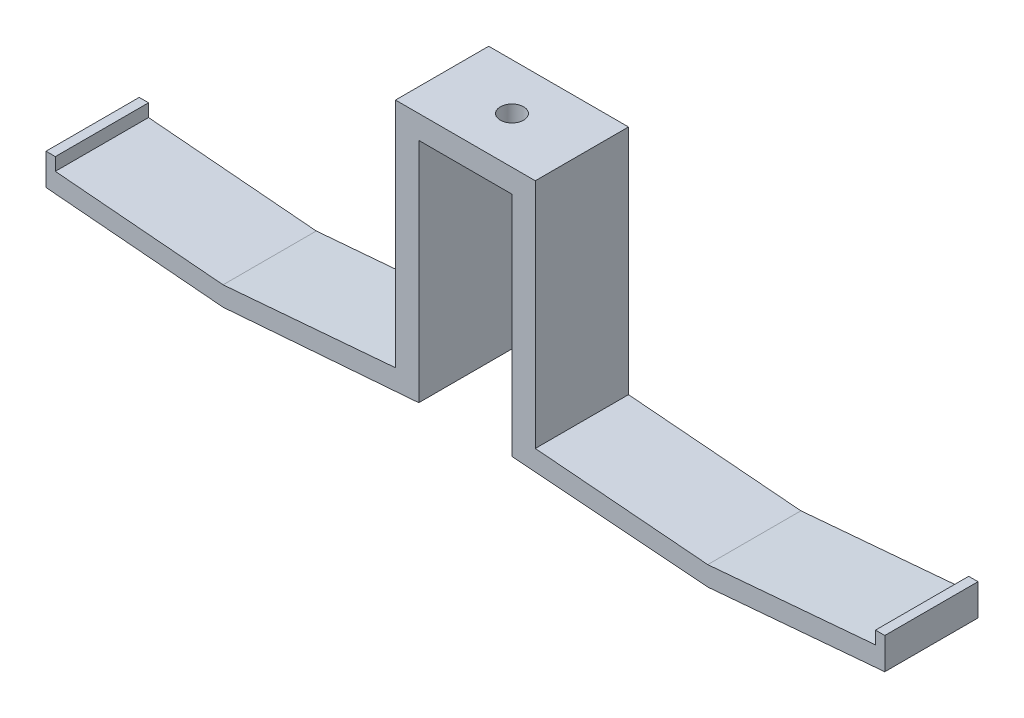
from build123d import *

# Parameters (mm, degrees)
BOSS_EXTRUDE1_DEPTH = 25.4
CUT_EXTRUDE1_REACH  = 139.665
SKETCH3_R           = 3.175


with BuildPart() as part:
    # Sketch2 → Boss-Extrude1 (new body)
    with BuildSketch(Plane.XY):
        Polygon((0, 0), (12.7, 0), (12.7, -61.9179737), (66.04, -66.051353419), (114.3, -61.9179737), (114.3, -53.351353419), (111.76, -53.351353419), (111.76, -56.8379737), (66.04, -60.753807118), (19.05, -56.8379737), (19.05, 0), (19.05, 6.35), (0, 6.35), align=None)
        Polygon((-12.7, 0), (0, 0), (0, 6.35), (-19.05, 6.35), (-19.05, 0), (-19.05, -56.8379737), (-66.04, -60.753807118), (-111.76, -56.8379737), (-111.76, -53.351353419), (-114.3, -53.351353419), (-114.3, -61.9179737), (-66.04, -66.051353419), (-12.7, -61.9179737), align=None)
    extrude(amount=BOSS_EXTRUDE1_DEPTH)

    # Sketch3 → Cut-Extrude1 (cut, up to next)
    with BuildSketch(Plane(origin=(0, 6.35, 0), x_dir=(1, 0, 0), z_dir=(0, 1, 0)), mode=Mode.PRIVATE) as cut_extrude1_sk1:
        with Locations(Location((0, -12.7, 0), (0, 0, 270))):
            Circle(SKETCH3_R)
    cut_extrude1_tool1 = extrude(cut_extrude1_sk1.sketch, amount=-CUT_EXTRUDE1_REACH, mode=Mode.PRIVATE) & part.part
    add(cut_extrude1_tool1.solids().sort_by_distance((0, 6.35, 12.7))[0], mode=Mode.SUBTRACT)


solid = part.part
